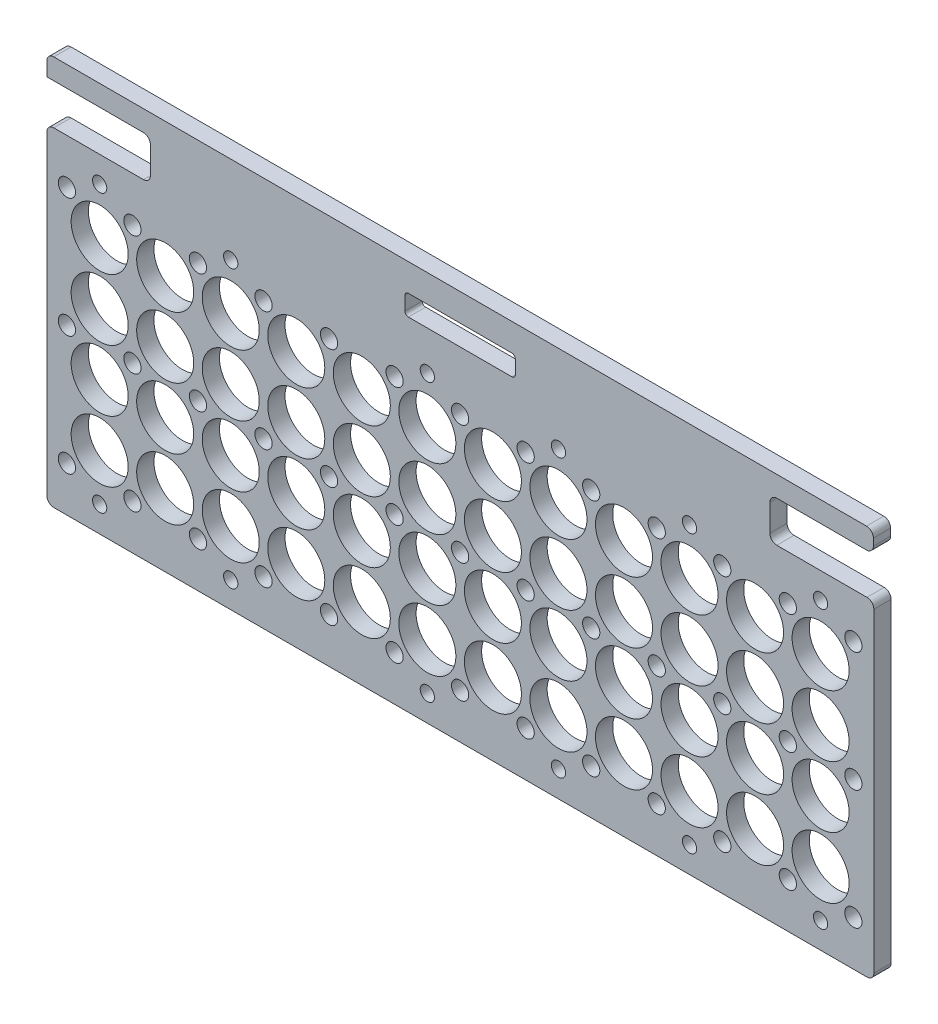
from build123d import *

# Parameters (mm, degrees)
SKETCH2_R           = 10.499946832
SKETCH2_R_2         = 2.625
BOSS_EXTRUDE1_DEPTH = 6.35
SKETCH3_R           = 3.175
CUT_EXTRUDE1_DEPTH  = 301.354777645
BOSS_EXTRUDE3_DEPTH = 6.35
FILLET1_R           = 2.54
CUT_EXTRUDE2_DEPTH  = 309.215396357
FILLET3_R           = 1.27


with BuildPart() as part:
    # Sketch2 → Boss-Extrude1 (new body)
    with BuildSketch(Plane.XY):
        Polygon((-19.430000002, 91.526), (-19.430000002, -23.708), (-19.430000002, -26.629), (285.048126016, -26.629), (285.048126016, -23.708), (285.048126016, 91.526), (285.048126016, 94.447), (-19.430000002, 94.447), align=None)
        Circle(SKETCH2_R, mode=Mode.SUBTRACT)
        with Locations((24.13, 0)):
            Circle(SKETCH2_R, mode=Mode.SUBTRACT)
        with Locations((48.26, 0)):
            Circle(SKETCH2_R, mode=Mode.SUBTRACT)
        with Locations((72.39, 0)):
            Circle(SKETCH2_R, mode=Mode.SUBTRACT)
        with Locations((24.13, 22.606)):
            Circle(SKETCH2_R, mode=Mode.SUBTRACT)
        with Locations((48.26, 22.606)):
            Circle(SKETCH2_R, mode=Mode.SUBTRACT)
        with Locations((72.39, 22.606)):
            Circle(SKETCH2_R, mode=Mode.SUBTRACT)
        with Locations((24.13, 45.212)):
            Circle(SKETCH2_R, mode=Mode.SUBTRACT)
        with Locations((48.26, 45.212)):
            Circle(SKETCH2_R, mode=Mode.SUBTRACT)
        with Locations((72.39, 45.212)):
            Circle(SKETCH2_R, mode=Mode.SUBTRACT)
        with Locations((24.13, 67.818)):
            Circle(SKETCH2_R, mode=Mode.SUBTRACT)
        with Locations((48.26, 67.818)):
            Circle(SKETCH2_R, mode=Mode.SUBTRACT)
        with Locations((72.39, 67.818)):
            Circle(SKETCH2_R, mode=Mode.SUBTRACT)
        with Locations((0, 22.606)):
            Circle(SKETCH2_R, mode=Mode.SUBTRACT)
        with Locations((0, 45.212)):
            Circle(SKETCH2_R, mode=Mode.SUBTRACT)
        with Locations((0, 67.818)):
            Circle(SKETCH2_R, mode=Mode.SUBTRACT)
        with Locations((96.52, 0)):
            Circle(SKETCH2_R, mode=Mode.SUBTRACT)
        with Locations((120.65, 0)):
            Circle(SKETCH2_R, mode=Mode.SUBTRACT)
        with Locations((144.78, 0)):
            Circle(SKETCH2_R, mode=Mode.SUBTRACT)
        with Locations((168.91, 0)):
            Circle(SKETCH2_R, mode=Mode.SUBTRACT)
        with Locations((193.04, 0)):
            Circle(SKETCH2_R, mode=Mode.SUBTRACT)
        with Locations((217.17, 0)):
            Circle(SKETCH2_R, mode=Mode.SUBTRACT)
        with Locations((241.3, 0)):
            Circle(SKETCH2_R, mode=Mode.SUBTRACT)
        with Locations((265.43, 0)):
            Circle(SKETCH2_R, mode=Mode.SUBTRACT)
        with Locations((96.52, 22.606)):
            Circle(SKETCH2_R, mode=Mode.SUBTRACT)
        with Locations((120.65, 22.606)):
            Circle(SKETCH2_R, mode=Mode.SUBTRACT)
        with Locations((144.78, 22.606)):
            Circle(SKETCH2_R, mode=Mode.SUBTRACT)
        with Locations((168.91, 22.606)):
            Circle(SKETCH2_R, mode=Mode.SUBTRACT)
        with Locations((193.04, 22.606)):
            Circle(SKETCH2_R, mode=Mode.SUBTRACT)
        with Locations((217.17, 22.606)):
            Circle(SKETCH2_R, mode=Mode.SUBTRACT)
        with Locations((241.3, 22.606)):
            Circle(SKETCH2_R, mode=Mode.SUBTRACT)
        with Locations((265.43, 22.606)):
            Circle(SKETCH2_R, mode=Mode.SUBTRACT)
        with Locations((96.52, 45.212)):
            Circle(SKETCH2_R, mode=Mode.SUBTRACT)
        with Locations((120.65, 45.212)):
            Circle(SKETCH2_R, mode=Mode.SUBTRACT)
        with Locations((144.78, 45.212)):
            Circle(SKETCH2_R, mode=Mode.SUBTRACT)
        with Locations((168.91, 45.212)):
            Circle(SKETCH2_R, mode=Mode.SUBTRACT)
        with Locations((193.04, 45.212)):
            Circle(SKETCH2_R, mode=Mode.SUBTRACT)
        with Locations((217.17, 45.212)):
            Circle(SKETCH2_R, mode=Mode.SUBTRACT)
        with Locations((241.3, 45.212)):
            Circle(SKETCH2_R, mode=Mode.SUBTRACT)
        with Locations((265.43, 45.212)):
            Circle(SKETCH2_R, mode=Mode.SUBTRACT)
        with Locations((96.52, 67.818)):
            Circle(SKETCH2_R, mode=Mode.SUBTRACT)
        with Locations((120.65, 67.818)):
            Circle(SKETCH2_R, mode=Mode.SUBTRACT)
        with Locations((144.78, 67.818)):
            Circle(SKETCH2_R, mode=Mode.SUBTRACT)
        with Locations((168.91, 67.818)):
            Circle(SKETCH2_R, mode=Mode.SUBTRACT)
        with Locations((193.04, 67.818)):
            Circle(SKETCH2_R, mode=Mode.SUBTRACT)
        with Locations((217.17, 67.818)):
            Circle(SKETCH2_R, mode=Mode.SUBTRACT)
        with Locations((241.3, 67.818)):
            Circle(SKETCH2_R, mode=Mode.SUBTRACT)
        with Locations((265.43, 67.818)):
            Circle(SKETCH2_R, mode=Mode.SUBTRACT)
        with Locations((0, 84.921973416)):
            Circle(SKETCH2_R_2, mode=Mode.SUBTRACT)
        with Locations((48.26, 84.921973416)):
            Circle(SKETCH2_R_2, mode=Mode.SUBTRACT)
        with Locations((217.17, 84.921973416)):
            Circle(SKETCH2_R_2, mode=Mode.SUBTRACT)
        with Locations((265.43, 84.921973416)):
            Circle(SKETCH2_R_2, mode=Mode.SUBTRACT)
        with Locations((120.65, 84.921973416)):
            Circle(SKETCH2_R_2, mode=Mode.SUBTRACT)
        with Locations((168.91, 84.921973416)):
            Circle(SKETCH2_R_2, mode=Mode.SUBTRACT)
        with Locations(Location((265.43, -17.103973416, 0), (0, 0, 180))):
            Circle(SKETCH2_R_2, mode=Mode.SUBTRACT)
        with Locations(Location((217.17, -17.103973416, 0), (0, 0, 180))):
            Circle(SKETCH2_R_2, mode=Mode.SUBTRACT)
        with Locations(Location((48.26, -17.103973416, 0), (0, 0, 180))):
            Circle(SKETCH2_R_2, mode=Mode.SUBTRACT)
        with Locations(Location((0, -17.103973416, 0), (0, 0, 180))):
            Circle(SKETCH2_R_2, mode=Mode.SUBTRACT)
        with Locations(Location((168.91, -17.103973416, 0), (0, 0, 180))):
            Circle(SKETCH2_R_2, mode=Mode.SUBTRACT)
        with Locations(Location((120.65, -17.103973416, 0), (0, 0, 180))):
            Circle(SKETCH2_R_2, mode=Mode.SUBTRACT)
    extrude(amount=BOSS_EXTRUDE1_DEPTH)

    # Sketch3 → Cut-Extrude1 (cut, through all)
    with BuildSketch(Plane.XY.offset(6.35)):
        with Locations((12.065, 77.895240196)):
            Circle(SKETCH3_R)
        with Locations(Location((12.065, -10.077240196, 0), (0, 0, 180))):
            Circle(SKETCH3_R)
        with Locations((36.195, 77.895240196)):
            Circle(SKETCH3_R)
        with Locations((60.325, 77.895240196)):
            Circle(SKETCH3_R)
        with Locations((84.455, 77.895240196)):
            Circle(SKETCH3_R)
        with Locations((108.585, 77.895240196)):
            Circle(SKETCH3_R)
        with Locations((132.715, 77.895240196)):
            Circle(SKETCH3_R)
        with Locations((156.845, 77.895240196)):
            Circle(SKETCH3_R)
        with Locations((180.975, 77.895240196)):
            Circle(SKETCH3_R)
        with Locations((205.105, 77.895240196)):
            Circle(SKETCH3_R)
        with Locations((229.235, 77.895240196)):
            Circle(SKETCH3_R)
        with Locations((253.365, 77.895240196)):
            Circle(SKETCH3_R)
        with Locations((277.495, 77.895240196)):
            Circle(SKETCH3_R)
        with Locations((-12.065, 77.895240196)):
            Circle(SKETCH3_R)
        with Locations(Location((277.495, -10.077240196, 0), (0, 0, 180))):
            Circle(SKETCH3_R)
        with Locations(Location((253.365, -10.077240196, 0), (0, 0, 180))):
            Circle(SKETCH3_R)
        with Locations(Location((229.235, -10.077240196, 0), (0, 0, 180))):
            Circle(SKETCH3_R)
        with Locations(Location((205.105, -10.077240196, 0), (0, 0, 180))):
            Circle(SKETCH3_R)
        with Locations(Location((180.975, -10.077240196, 0), (0, 0, 180))):
            Circle(SKETCH3_R)
        with Locations(Location((156.845, -10.077240196, 0), (0, 0, 180))):
            Circle(SKETCH3_R)
        with Locations(Location((132.715, -10.077240196, 0), (0, 0, 180))):
            Circle(SKETCH3_R)
        with Locations(Location((108.585, -10.077240196, 0), (0, 0, 180))):
            Circle(SKETCH3_R)
        with Locations(Location((84.455, -10.077240196, 0), (0, 0, 180))):
            Circle(SKETCH3_R)
        with Locations(Location((60.325, -10.077240196, 0), (0, 0, 180))):
            Circle(SKETCH3_R)
        with Locations(Location((36.195, -10.077240196, 0), (0, 0, 180))):
            Circle(SKETCH3_R)
        with Locations(Location((-12.065, -10.077240196, 0), (0, 0, 180))):
            Circle(SKETCH3_R)
        with Locations((12.065, 33.909)):
            Circle(SKETCH3_R)
        with Locations((36.195, 33.909)):
            Circle(SKETCH3_R)
        with Locations((60.325, 33.909)):
            Circle(SKETCH3_R)
        with Locations((84.455, 33.909)):
            Circle(SKETCH3_R)
        with Locations((108.585, 33.909)):
            Circle(SKETCH3_R)
        with Locations((132.715, 33.909)):
            Circle(SKETCH3_R)
        with Locations((156.845, 33.909)):
            Circle(SKETCH3_R)
        with Locations((180.975, 33.909)):
            Circle(SKETCH3_R)
        with Locations((205.105, 33.909)):
            Circle(SKETCH3_R)
        with Locations((229.235, 33.909)):
            Circle(SKETCH3_R)
        with Locations((253.365, 33.909)):
            Circle(SKETCH3_R)
        with Locations((277.495, 33.909)):
            Circle(SKETCH3_R)
        with Locations((-12.065, 33.909)):
            Circle(SKETCH3_R)
    extrude(amount=-CUT_EXTRUDE1_DEPTH, mode=Mode.SUBTRACT)

    # Sketch7 → Boss-Extrude3 (add, through all)
    with BuildSketch(Plane.XY.offset(6.35)):
        Polygon((246.760000082, 93.177000044), (18.670000078, 93.177000044), (18.670000078, 109.443973562), (-19.429999922, 109.443973562), (-19.429999922, 117.063973562), (284.860000082, 117.063973562), (284.860000082, 109.443973562), (246.760000082, 109.443973562), align=None)
    extrude(amount=-BOSS_EXTRUDE3_DEPTH)

    # Fillet1
    fillet1_edges = [part.edges().sort_by_distance(p)[0] for p in [
        (-19.430000002, 94.447, 3.175),
        (285.048126016, 94.447, 3.175),
        (285.048126016, -26.629, 3.175),
        (-19.430000002, -26.629, 3.175),
        (18.670000078, 94.447, 3.175),
        (246.760000082, 94.447, 3.175),
        (246.760000082, 109.443973562, 3.175),
        (18.670000078, 109.443973562, 3.175),
        (-19.429999922, 117.063973562, 3.175),
        (284.860000082, 117.063973562, 3.175),
        (284.860000082, 109.443973562, 3.175),
    ]]
    fillet(fillet1_edges, radius=FILLET1_R)

    # Sketch10 → Cut-Extrude2 (cut, through all)
    with BuildSketch(Plane.XY.offset(6.35)):
        Polygon((132.71500008, 106.961583302), (153.03500008, 106.961583302), (153.03500008, 99.391583202), (112.39500008, 99.391583202), (112.39500008, 106.961583302), align=None)
    extrude(amount=-CUT_EXTRUDE2_DEPTH, mode=Mode.SUBTRACT)

    # Fillet3
    fillet3_edges = [part.edges().sort_by_distance(p)[0] for p in [
        (112.39500008, 106.961583302, 3.175),
        (153.03500008, 106.961583302, 3.175),
        (153.03500008, 99.391583202, 3.175),
        (112.39500008, 99.391583202, 3.175),
    ]]
    fillet(fillet3_edges, radius=FILLET3_R)


solid = part.part
